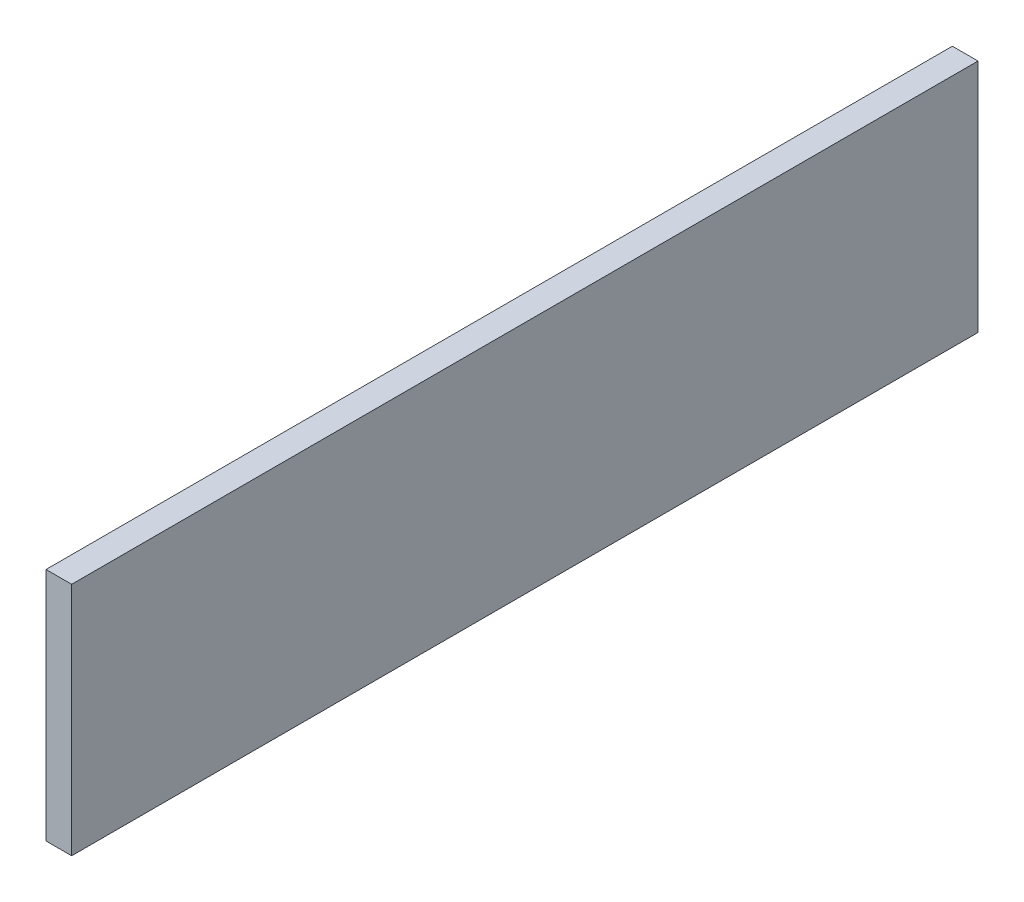
from build123d import *

# Parameters (mm, degrees)
SKETCH_1_W      = 424
SKETCH_1_H      = 110
EXTRUDE_1_DEPTH = 12


with BuildPart() as part:
    # 草图1 → 凸台-拉伸1 (new body)
    with BuildSketch(Plane(origin=(0, 0, 0), x_dir=(0, 0, -1), z_dir=(1, 0, 0))):
        Rectangle(SKETCH_1_W, SKETCH_1_H)
    extrude(amount=EXTRUDE_1_DEPTH)


solid = part.part
